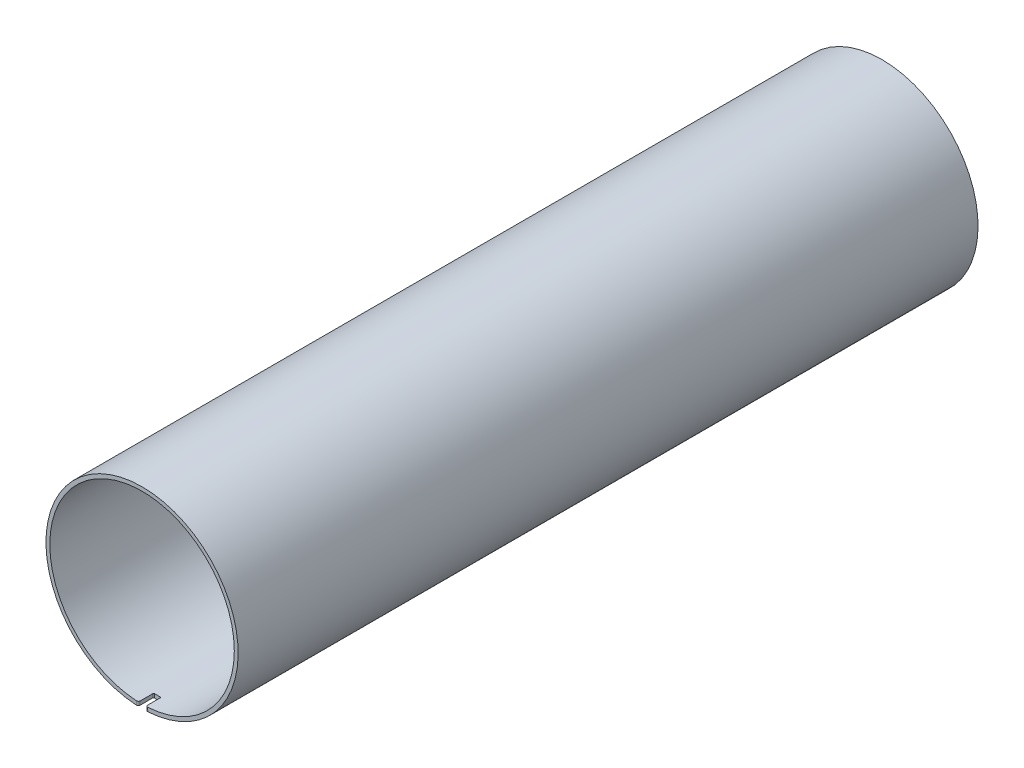
from build123d import *

# Parameters (mm, degrees)
SKETCH_1_R          = 50
SKETCH_1_R_2        = 48
EXTRUDE_1_DEPTH     = 385
CUT_EXTRUDE_START   = -8
CUT_EXTRUDE_1_DEPTH = 8
FILLET_1_R          = 0.5
FILLET_2_R          = 1


with BuildPart() as part:
    # Эскиз1 → Бобышка-Вытянуть1 (new body)
    with BuildSketch(Plane.XY):
        Circle(SKETCH_1_R)
        Circle(SKETCH_1_R_2, mode=Mode.SUBTRACT)
    extrude(amount=EXTRUDE_1_DEPTH)

    # Эскиз3 → Вырез-Вытянуть1 (cut)
    with BuildSketch(Plane.XY.offset(385).offset(CUT_EXTRUDE_START)):
        with BuildLine():
            Line((-1.92, -47.961584628), (-2, -49.959983987))
            ThreePointArc((-2, -49.959983987), (0, -50), (2, -49.959983987))
            Line((2, -49.959983987), (1.92, -47.961584628))
            ThreePointArc((1.92, -47.961584628), (0, -48), (-1.92, -47.961584628))
        make_face()
    cut_extrude_1 = extrude(amount=CUT_EXTRUDE_1_DEPTH, mode=Mode.SUBTRACT)

    # Зеркальное отражение3: Вырез-Вытянуть1 across plane
    add(cut_extrude_1.mirror(Plane.XY.offset(192.5)), mode=Mode.SUBTRACT)

    # Скругление1
    fillet_1_edges = [part.edges().sort_by_distance(p)[0] for p in [
        (-1.96, -48.960784307, 377),
        (1.96, -48.960784307, 377),
        (1.96, -48.960784307, 8),
        (-1.96, -48.960784307, 8),
    ]]
    fillet(fillet_1_edges, radius=FILLET_1_R)

    # Скругление2
    fillet_2_edges = [part.edges().sort_by_distance(p)[0] for p in [
        (1.96, -48.960784307, 385),
        (-1.96, -48.960784307, 385),
        (1.96, -48.960784307, 0),
        (-1.96, -48.960784307, 0),
    ]]
    fillet(fillet_2_edges, radius=FILLET_2_R)


solid = part.part
